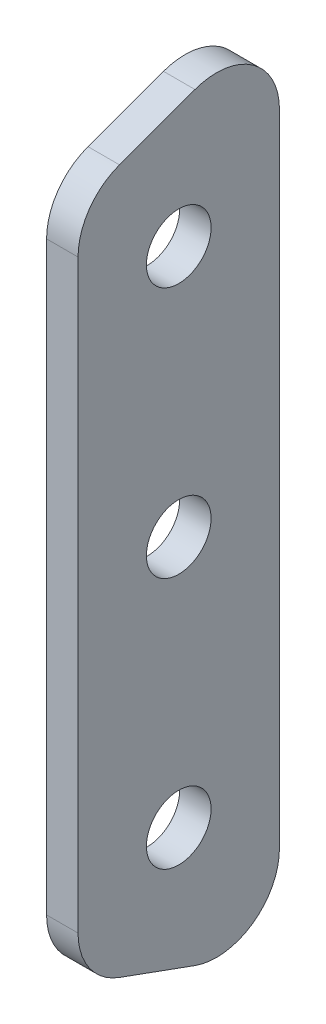
from build123d import *

# Parameters (mm, degrees)
BOSS_EXTRUDE1_DEPTH     = 1.5875
F_1_4_CLEARANCE_HOLE1_D = 6.5278
FILLET1_R               = 6.35


with BuildPart() as part:
    # Sketch2 → Boss-Extrude1 (new, symmetric)
    with BuildSketch(Plane(origin=(0, 0, 0), x_dir=(0, 0, -1), z_dir=(1, 0, 0))):
        Polygon((4.639999991, 33.98455115), (4.639999991, -33.98455115), (24.959999991, -41.373642063), (24.959999991, 41.373642063), align=None)
    extrude(amount=BOSS_EXTRUDE1_DEPTH, both=True)

    # 1/4 Clearance Hole1 (through all)
    with Locations(Plane(origin=(1.5875, 0, 0), x_dir=(0, 0, -1), z_dir=(1, 0, 0))):
        with Locations((14.799999991, 0), (14.799999991, 25.4), (14.799999991, -25.4)):
            Hole(F_1_4_CLEARANCE_HOLE1_D / 2)

    # Fillet1
    fillet1_edges = [part.edges().sort_by_distance(p)[0] for p in [
        (0, 41.373642063, -24.959999991),
        (0, -41.373642063, -24.959999991),
        (0, -33.98455115, -4.639999991),
        (0, 33.98455115, -4.639999991),
    ]]
    fillet(fillet1_edges, radius=FILLET1_R)


solid = part.part
